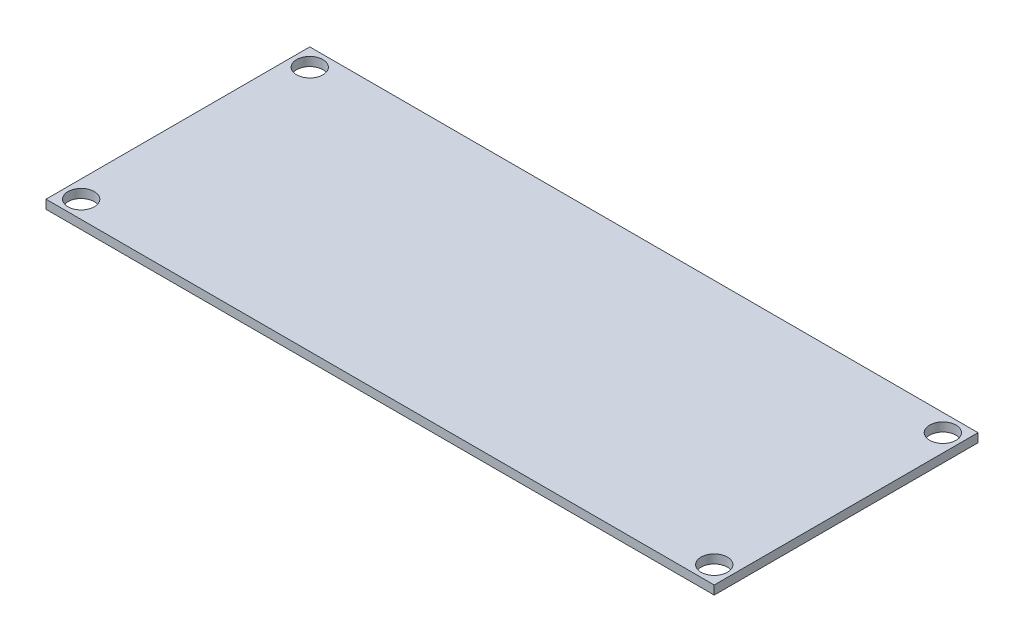
from build123d import *

# Parameters (mm, degrees)
CROQUIS1_W                   = 76
CROQUIS1_H                   = 30
SALIENTE_EXTRUIR1_DEPTH      = 1
TALADRO_DE_MARGEN_PARA_M31_D = 3


with BuildPart() as part:
    # Croquis1 → Saliente-Extruir1 (new body)
    with BuildSketch(Plane(origin=(0, 0, 0), x_dir=(1, 0, 0), z_dir=(0, 1, 0))):
        Rectangle(CROQUIS1_W, CROQUIS1_H)
    extrude(amount=SALIENTE_EXTRUIR1_DEPTH)

    # Taladro de margen para M31 (through all)
    with Locations(Plane(origin=(-36, 1, -13), x_dir=(0, 0, 1), z_dir=(0, 1, 0))):
        with Locations((0, 0), (0, 72), (26, 72), (26, 0)):
            Hole(TALADRO_DE_MARGEN_PARA_M31_D / 2)


solid = part.part
